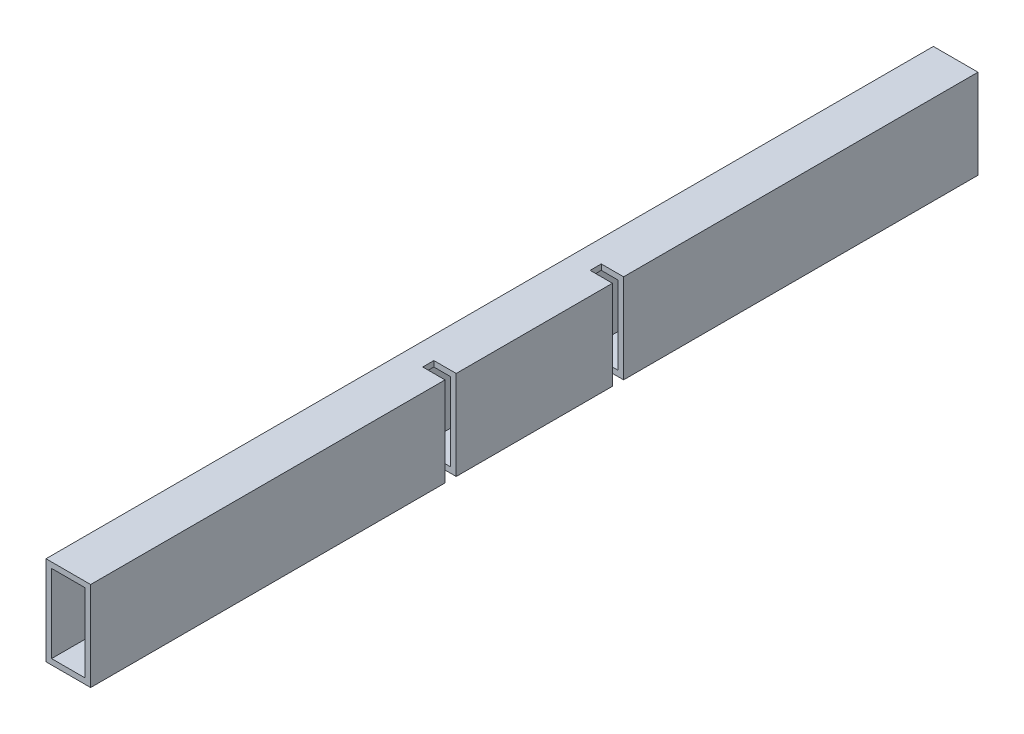
from build123d import *

# Parameters (mm, degrees)
SKETCH1_W           = 25.4
SKETCH1_H           = 50.8
SKETCH1_W_2         = 19.05
SKETCH1_H_2         = 44.45
BOSS_EXTRUDE1_DEPTH = 252.476
SKETCH2_W           = 6.35
SKETCH2_H           = 50.8
CUT_EXTRUDE1_DEPTH  = 12.7


with BuildPart() as part:
    # Sketch1 → Boss-Extrude1 (new, symmetric)
    with BuildSketch(Plane.XY):
        Rectangle(SKETCH1_W, SKETCH1_H)
        Rectangle(SKETCH1_W_2, SKETCH1_H_2, mode=Mode.SUBTRACT)
    extrude(amount=BOSS_EXTRUDE1_DEPTH, both=True)

    # Sketch2 → Cut-Extrude1 (cut)
    with BuildSketch(Plane(origin=(12.7, 0, 0), x_dir=(0, 0, -1), z_dir=(1, 0, 0))):
        with Locations((47.625, 0)):
            Rectangle(SKETCH2_W, SKETCH2_H)
        with Locations((-47.625, 0)):
            Rectangle(SKETCH2_W, SKETCH2_H)
    extrude(amount=-CUT_EXTRUDE1_DEPTH, mode=Mode.SUBTRACT)


solid = part.part
